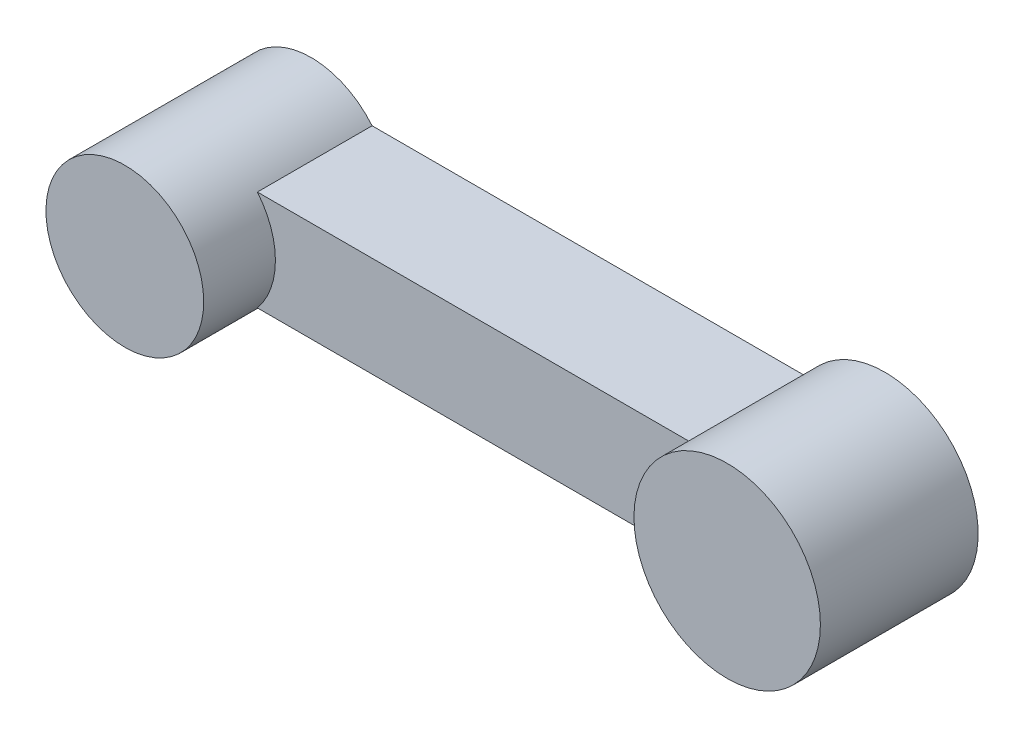
from build123d import *

# Parameters (mm, degrees)
SKETCH_3_W    = 80
SKETCH_3_H    = 14
BAR_DEPTH     = 16
SKETCH_4_R    = 11
ROOTHUB_DEPTH = 26
SKETCH_5_R    = 13
ENDHUB_DEPTH  = 22


with BuildPart() as part:
    # 草图3 → Bar (new body)
    with BuildSketch(Plane.XY):
        with Locations((60, 12)):
            Rectangle(SKETCH_3_W, SKETCH_3_H)
    extrude(amount=BAR_DEPTH)

    # 草图4 → RootHub (add)
    with BuildSketch(Plane.XY):
        with Locations(Location((20, 12, 0), (0, 0, 320.478803641))):
            Circle(SKETCH_4_R)
    extrude(amount=ROOTHUB_DEPTH)

    # 草图5 → EndHub (add)
    with BuildSketch(Plane.XY):
        with Locations(Location((100, 12, 0), (0, 0, 212.578970393))):
            Circle(SKETCH_5_R)
    extrude(amount=ENDHUB_DEPTH)


solid = part.part
